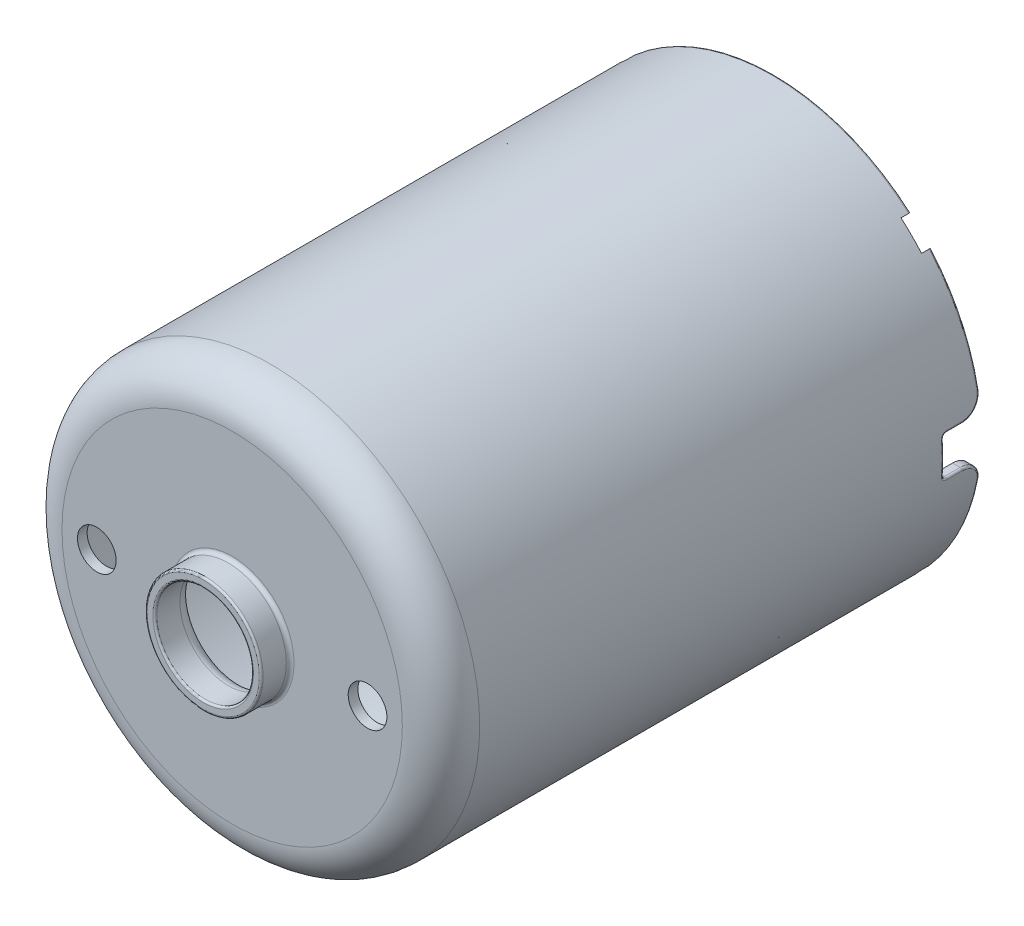
from build123d import *

# Parameters (mm, degrees)
FILLET1_R          = 0.1
CUT_EXTRUDE1_DEPTH = 0.5
CUT_EXTRUDE2_REACH = 38.976
FILLET2_R          = 0.1
CUT_EXTRUDE3_REACH = 33.895
SKETCH6_R          = 1


with BuildPart() as part:
    # Sketch1 → Revolve1 (revolve)
    with BuildSketch(Plane(origin=(0, 0, 0), x_dir=(0, 0, -1), z_dir=(1, 0, 0)), mode=Mode.PRIVATE) as revolve1_sk:
        with BuildLine():
            Line((0, 3.2), (0, 8.8))
            ThreePointArc((0, 8.8), (0.585786438, 10.214213562), (2, 10.8))
            Line((2, 10.8), (28, 10.8))
            Line((28, 10.8), (28, 10.3))
            Line((28, 10.3), (2, 10.3))
            ThreePointArc((2, 10.3), (0.939339828, 9.860660172), (0.5, 8.8))
            Line((0.5, 8.8), (0.5, 3.2))
            ThreePointArc((0.5, 3.2), (0.294974747, 2.705025253), (-0.2, 2.5))
            Line((-0.2, 2.5), (-1.5, 2.5))
            Line((-1.5, 2.5), (-1.5, 3))
            Line((-1.5, 3), (-0.2, 3))
            ThreePointArc((-0.2, 3), (-0.058578644, 3.058578644), (0, 3.2))
        make_face()
    revolve(revolve1_sk.sketch.rotate(Axis((0, 0, 0), (0, 0, -1)), 90), axis=Axis((0, 0, 0), (0, 0, -1)))

    # Fillet1
    fillet1_edges = [part.edges().sort_by_distance(p)[0] for p in [
        (-3, 0, 1.5),
        (-2.5, 0, 1.5),
    ]]
    fillet(fillet1_edges, radius=FILLET1_R)

    # Sketch2 → Cut-Extrude1 (cut)
    with BuildSketch(Plane(origin=(0, 0, -28), x_dir=(-1, 0, 0), z_dir=(0, 0, -1))):
        with BuildLine():
            Line((7.087986657, 8.148646829), (6.733535965, 7.794196136))
            ThreePointArc((6.733535965, 7.794196136), (7.283199846, 7.283199846), (7.794196136, 6.733535965))
            Line((7.794196136, 6.733535965), (8.148646829, 7.087986657))
            ThreePointArc((8.148646829, 7.087986657), (7.636753237, 7.636753237), (7.087986657, 8.148646829))
        make_face()
        with BuildLine():
            Line((6.733535965, -7.794196136), (7.087986657, -8.148646829))
            ThreePointArc((7.087986657, -8.148646829), (7.636753237, -7.636753237), (8.148646829, -7.087986657))
            Line((8.148646829, -7.087986657), (7.794196136, -6.733535965))
            ThreePointArc((7.794196136, -6.733535965), (7.283199846, -7.283199846), (6.733535965, -7.794196136))
        make_face()
        with BuildLine():
            Line((-7.794196136, -6.733535965), (-8.148646829, -7.087986657))
            ThreePointArc((-8.148646829, -7.087986657), (-7.636753237, -7.636753237), (-7.087986657, -8.148646829))
            Line((-7.087986657, -8.148646829), (-6.733535965, -7.794196136))
            ThreePointArc((-6.733535965, -7.794196136), (-7.283199846, -7.283199846), (-7.794196136, -6.733535965))
        make_face()
        with BuildLine():
            Line((-6.733535965, 7.794196136), (-7.087986657, 8.148646829))
            ThreePointArc((-7.087986657, 8.148646829), (-7.636753237, 7.636753237), (-8.148646829, 7.087986657))
            Line((-8.148646829, 7.087986657), (-7.794196136, 6.733535965))
            ThreePointArc((-7.794196136, 6.733535965), (-7.283199846, 7.283199846), (-6.733535965, 7.794196136))
        make_face()
    extrude(amount=-CUT_EXTRUDE1_DEPTH, mode=Mode.SUBTRACT)

    # Sketch5 → Cut-Extrude2 (cut, up to next)
    with BuildSketch(Plane(origin=(10.8, 0, 0), x_dir=(0, 0, -1), z_dir=(1, 0, 0)), mode=Mode.PRIVATE) as cut_extrude2_sk1:
        with BuildLine():
            ThreePointArc((26, 0.8), (26.058578644, 0.941421356), (26.2, 1))
            Line((26.2, 1), (27, 1))
            ThreePointArc((27, 1), (27.707106781, 1.292893219), (28, 2))
            Line((28, 2), (28, -2))
            ThreePointArc((28, -2), (27.707106781, -1.292893219), (27, -1))
            Line((27, -1), (26.2, -1))
            ThreePointArc((26.2, -1), (26.058578644, -0.941421356), (26, -0.8))
            Line((26, -0.8), (26, 0.8))
        make_face()
    cut_extrude2_tool1 = extrude(cut_extrude2_sk1.sketch, amount=-CUT_EXTRUDE2_REACH, mode=Mode.PRIVATE) & part.part
    add(cut_extrude2_tool1.solids().sort_by_distance((10.8, 0, -27.079268))[0], mode=Mode.SUBTRACT)

    # Fillet2
    fillet2_edges = [part.edges().sort_by_distance(p)[0] for p in [
        (10.75889989, 0.941314589, -26.058471962),
        (10.753604047, 1, -26.6),
        (10.722033002, -1.295379599, -27.70958445),
        (10.792579855, 0.400275009, -26),
        (10.722033001, 1.29537959, -27.709584458),
        (10.75889989, -0.941314591, -26.058471961),
        (10.753604047, -1, -26.6),
        (0, 10.8, -28),
        (-10.8, 0, -28),
        (0, -10.8, -28),
        (9.719754106, -4.708118534, -28),
        (9.719754106, 4.708118534, -28),
    ]]
    fillet(fillet2_edges, radius=FILLET2_R)

    # Sketch6 → Cut-Extrude3 (cut, up to next)
    with BuildSketch(Plane.XY, mode=Mode.PRIVATE) as cut_extrude3_sk1:
        with Locations((7, 0)):
            Circle(SKETCH6_R)
    cut_extrude3_tool1 = extrude(cut_extrude3_sk1.sketch, amount=-CUT_EXTRUDE3_REACH, mode=Mode.PRIVATE) & part.part
    # Sketch6 → Cut-Extrude3 (cut, up to next)
    with BuildSketch(Plane.XY, mode=Mode.PRIVATE) as cut_extrude3_sk2:
        with Locations((-7, 0)):
            Circle(SKETCH6_R)
    cut_extrude3_tool2 = extrude(cut_extrude3_sk2.sketch, amount=-CUT_EXTRUDE3_REACH, mode=Mode.PRIVATE) & part.part
    add(cut_extrude3_tool1.solids().sort_by_distance((7, 0, 0))[0], mode=Mode.SUBTRACT)
    add(cut_extrude3_tool2.solids().sort_by_distance((-7, 0, 0))[0], mode=Mode.SUBTRACT)


solid = part.part
